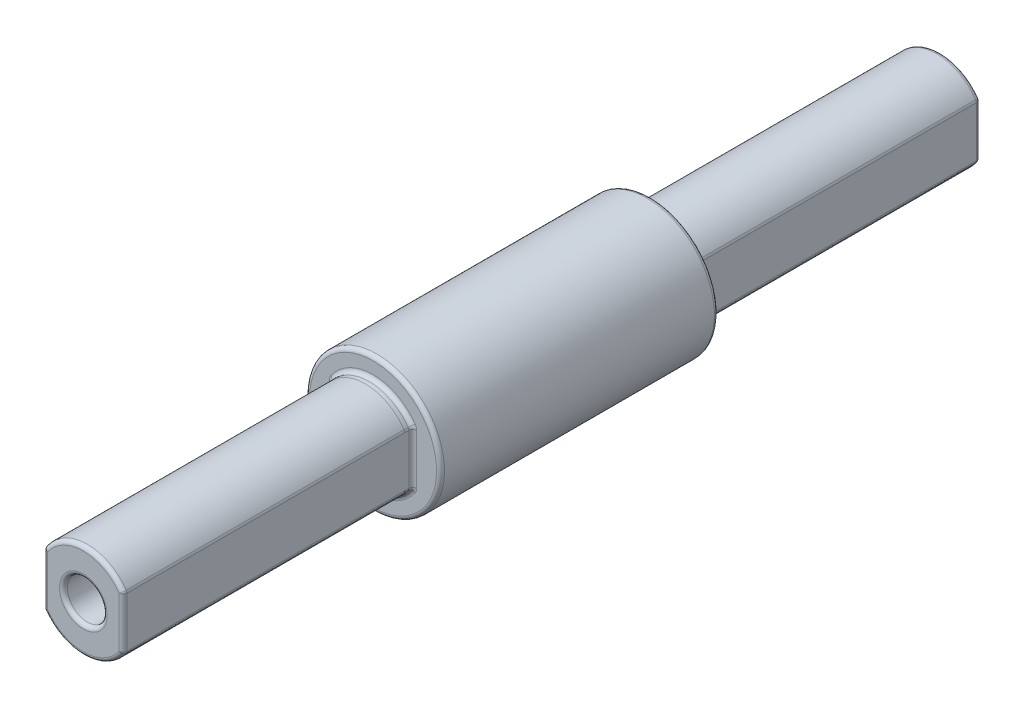
from build123d import *

# Parameters (mm, degrees)
CORTAR_EXTRUIR1_REACH = 57.322
REDONDEO2_R           = 0.5


with BuildPart() as part:
    # Croquis1 → Revolución4 (revolve)
    with BuildSketch(Plane(origin=(0, 0, 0), x_dir=(0, 0, -1), z_dir=(1, 0, 0)), mode=Mode.PRIVATE) as revoluci_n4_sk:
        Polygon((-17.5, 8.5), (-17.5, 6), (-18.5, 6), (-54, 6), (-54, 2.5), (-17.5, 2.5), (0, 2.5), (0, 8.5), align=None)
    revolve(revoluci_n4_sk.sketch.rotate(Axis((0, 0, 55.074829932), (0, 0, -1)), 90), axis=Axis((0, 0, 55.074829932), (0, 0, -1)))

    # Cortar-Extruir1: up to this face of the body (flat: up to its plane)
    cortar_extruir1_end = Plane(part.part.faces().sort_by_distance((-8.259583694, 0, 17.5))[0])
    # Croquis3 → Cortar-Extruir1 (cut, up to the picked face)
    with BuildSketch(Plane.XY.offset(54), mode=Mode.PRIVATE) as cortar_extruir1_sk1:
        with BuildLine():
            Line((-5, 3.31662479), (-5, -3.31662479))
            ThreePointArc((-5, -3.31662479), (-6, 0), (-5, 3.31662479))
        make_face()
    cortar_extruir1_tool1 = split(extrude(cortar_extruir1_sk1.sketch, amount=-CORTAR_EXTRUIR1_REACH, mode=Mode.PRIVATE), bisect_by=cortar_extruir1_end, keep=Keep.BOTH, mode=Mode.PRIVATE)
    # Croquis3 → Cortar-Extruir1 (cut, up to the picked face)
    with BuildSketch(Plane.XY.offset(54), mode=Mode.PRIVATE) as cortar_extruir1_sk2:
        with BuildLine():
            Line((5, 3.31662479), (5, -3.31662479))
            ThreePointArc((5, -3.31662479), (6, 0), (5, 3.31662479))
        make_face()
    cortar_extruir1_tool2 = split(extrude(cortar_extruir1_sk2.sketch, amount=-CORTAR_EXTRUIR1_REACH, mode=Mode.PRIVATE), bisect_by=cortar_extruir1_end, keep=Keep.BOTH, mode=Mode.PRIVATE)
    add(cortar_extruir1_tool1.solids().sort_by(Axis((-5.403002, 0, 54), (0, 0, -1)))[0], mode=Mode.SUBTRACT)
    add(cortar_extruir1_tool2.solids().sort_by(Axis((5.403002, 0, 54), (0, 0, -1)))[0], mode=Mode.SUBTRACT)

    # Redondeo2
    redondeo2_edges = [part.edges().sort_by_distance(p)[0] for p in [
        (0, -6, 54),
        (0, -6, 17.5),
        (5, 3.31662479, 35.75),
        (5, 0, 54),
        (5, 0, 17.5),
        (5, -3.31662479, 35.75),
        (5, -3.31662479, 35.75),
        (5, 3.31662479, 35.75),
        (-5, 0, 54),
        (-5, 0, 17.5),
        (-5, 3.31662479, 35.75),
        (-5, 3.31662479, 35.75),
        (-2.5, 0, 54),
        (0, 6, 54),
        (0, 6, 17.5),
        (-8.5, 0, 17.5),
    ]]
    fillet(redondeo2_edges, radius=REDONDEO2_R)

    # Simetría1: part across plane


with BuildPart() as part_1:
    add(part.part)
    add(part.part.mirror(Plane.XY))


solid = part_1.part
